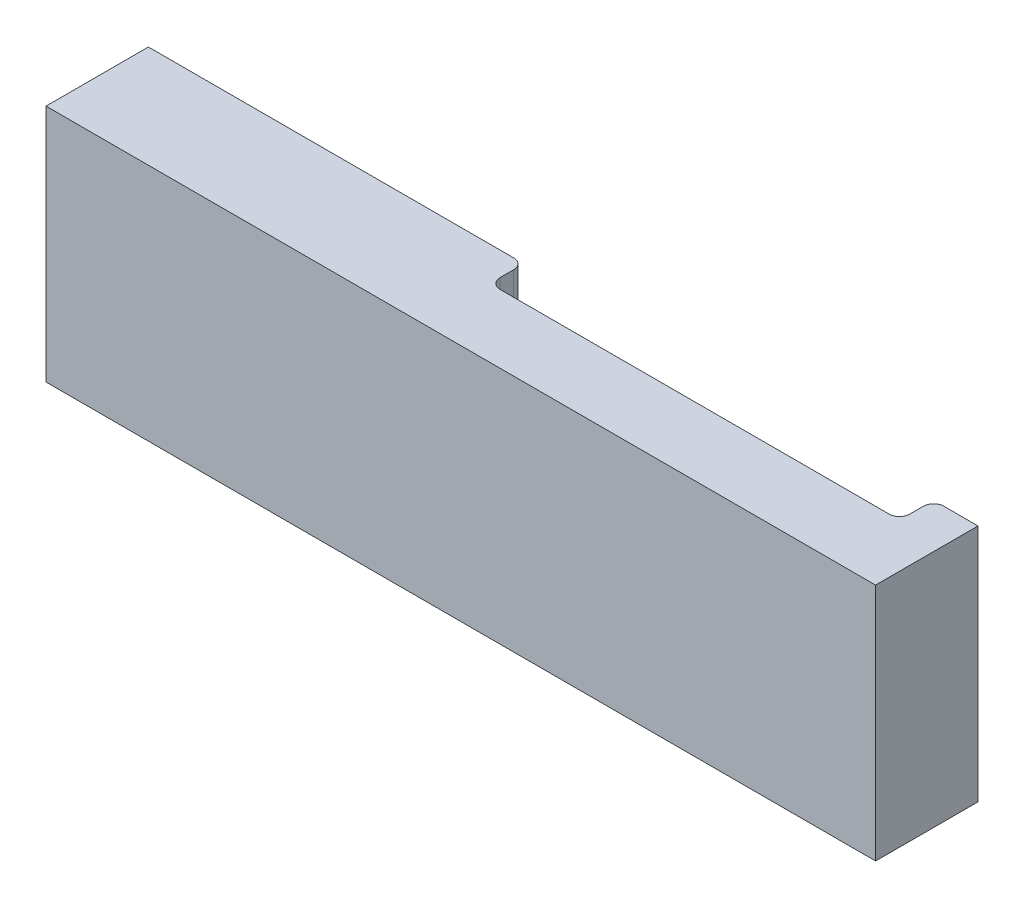
from build123d import *

# Parameters (mm, degrees)
SKETCH1_W           = 243
SKETCH1_H           = 30
BOSS_EXTRUDE1_DEPTH = 70
SKETCH2_W           = 120
SKETCH2_H           = 10
CUT_EXTRUDE1_DEPTH  = 70
FILLET1_R           = 3
SKETCH3_R           = 3
CUT_EXTRUDE2_DEPTH  = 20
SKETCH4_R           = 11.000191916
SKETCH4_R_2         = 5.90738233
BOSS_EXTRUDE2_DEPTH = 39
SKETCH5_R           = 1.5
CUT_EXTRUDE3_DEPTH  = 20


with BuildPart() as part:
    # Sketch1 → Boss-Extrude1 (new body)
    with BuildSketch(Plane(origin=(0, 0, 0), x_dir=(1, 0, 0), z_dir=(0, 1, 0))):
        with Locations((-94.428984733, -7.936828819)):
            Rectangle(SKETCH1_W, SKETCH1_H)
    extrude(amount=BOSS_EXTRUDE1_DEPTH)

    # Sketch2 → Cut-Extrude1 (cut)
    with BuildSketch(Plane(origin=(0, 70, 0), x_dir=(1, 0, 0), z_dir=(0, 1, 0))):
        with Locations((-45.928984733, 2.063171181)):
            Rectangle(SKETCH2_W, SKETCH2_H)
    extrude(amount=-CUT_EXTRUDE1_DEPTH, mode=Mode.SUBTRACT)

    # Fillet1
    fillet1_edges = [part.edges().sort_by_distance(p)[0] for p in [
        (14.071015267, 35, -7.063171181),
        (14.071015267, 35, 2.936828819),
        (-105.928984733, 35, 2.936828819),
        (-105.928984733, 35, -7.063171181),
    ]]
    fillet(fillet1_edges, radius=FILLET1_R)

    # Sketch3 → Cut-Extrude2 (cut)
    with BuildSketch(Plane(origin=(0, 0, 0), x_dir=(-1, 0, 0), z_dir=(0, -1, 0))):
        with Locations(Location((51.298984733, -12.077870123, 0), (0, 0, 90))):
            Circle(SKETCH3_R)
        with Locations(Location((185.928984733, -2.936828819, 0), (0, 0, 90))):
            Circle(SKETCH3_R)
    extrude(amount=-CUT_EXTRUDE2_DEPTH, mode=Mode.SUBTRACT)

    # Sketch4 → Boss-Extrude2 (add)
    with BuildSketch(Plane(origin=(0, 0, 0), x_dir=(-1, 0, 0), z_dir=(0, -1, 0))):
        with Locations((188.57546064, -9.351449297)):
            Circle(SKETCH4_R)
        with Locations((51.298984733, -12.077870123)):
            Circle(SKETCH4_R_2)
    extrude(amount=-BOSS_EXTRUDE2_DEPTH)

    # Sketch5 → Cut-Extrude3 (cut)
    with BuildSketch(Plane(origin=(0, 0, 0), x_dir=(-1, 0, 0), z_dir=(0, -1, 0))):
        with Locations(Location((51.298984733, -12.936828819, 0), (0, 0, 90))):
            Circle(SKETCH5_R)
        with Locations(Location((185.928984733, -2.936828819, 0), (0, 0, 90))):
            Circle(SKETCH5_R)
    extrude(amount=-CUT_EXTRUDE3_DEPTH, mode=Mode.SUBTRACT)


solid = part.part
